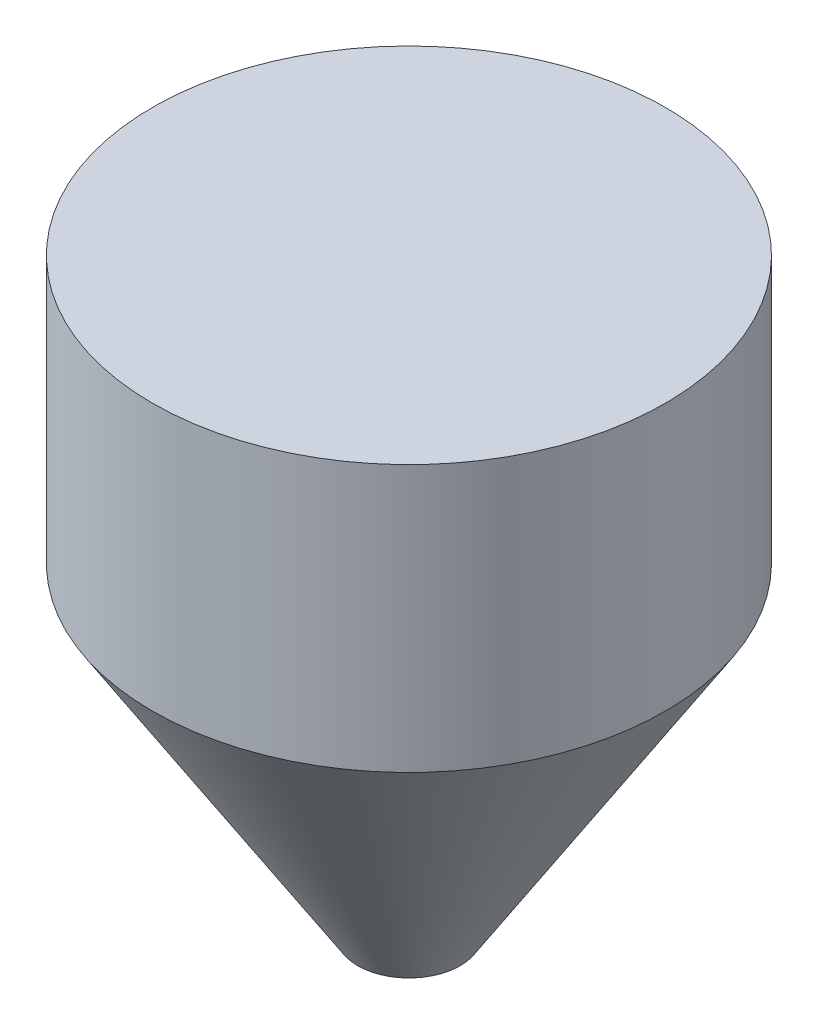
from build123d import *

# Parameters (mm, degrees)
CROQUIS1_R              = 100
SALIENTE_EXTRUIR1_DEPTH = 104
CROQUIS3_R              = 20
CROQUIS2_R              = 100


with BuildPart() as part:
    # Croquis1 → Saliente-Extruir1 (new body)
    with BuildSketch(Plane(origin=(0, 0, 0), x_dir=(1, 0, 0), z_dir=(0, 1, 0))):
        with Locations(Location((0, 0, 0), (0, 0, 270))):
            Circle(CROQUIS1_R)
    extrude(amount=-SALIENTE_EXTRUIR1_DEPTH)

    # Croquis3 → Recubrir1 section 0
    with BuildSketch(Plane(origin=(0, -230, 0), x_dir=(1, 0, 0), z_dir=(0, 1, 0))):
        Circle(CROQUIS3_R)
    # Croquis2 → Recubrir1 section 1
    with BuildSketch(Plane.XZ.offset(104)):
        Circle(CROQUIS2_R)
    loft()


solid = part.part
